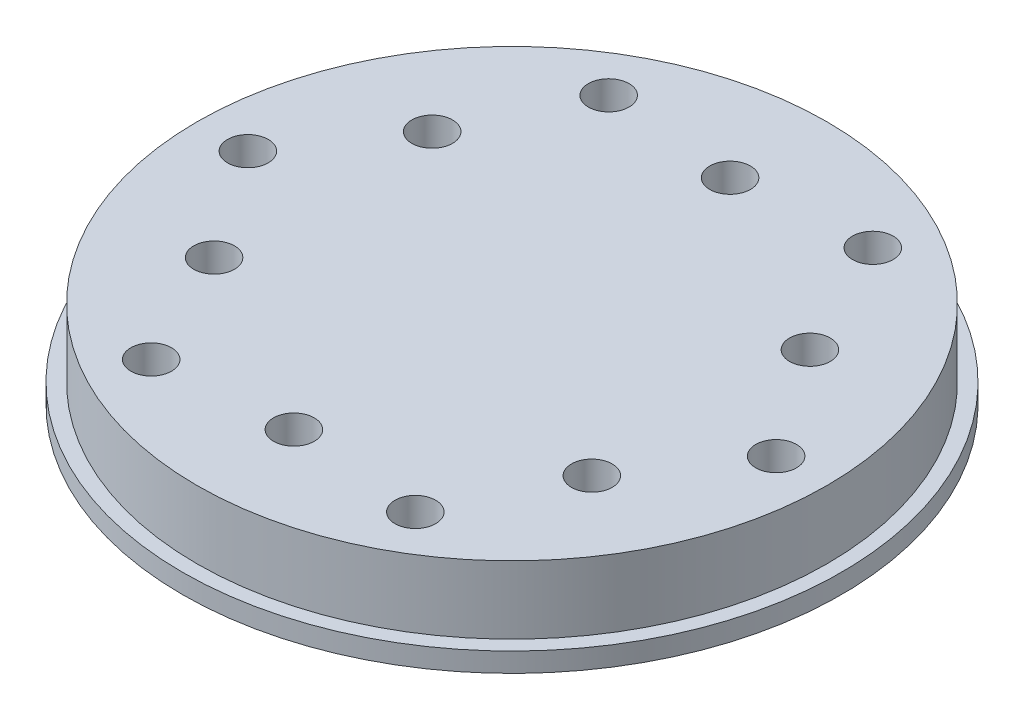
from build123d import *

# Parameters (mm, degrees)
SKETCH2_R             = 32.5
SKETCH2_R_2           = 6.5
SKETCH2_R_3           = 1.5
BOSS_EXTRUDE1_DEPTH   = 10
M5X0_8_TAPPED_HOLE1_D = 4.2
BOSS_EXTRUDE2_START   = -6.5
SKETCH8_R             = 6.5
BOSS_EXTRUDE2_DEPTH   = 6.5
SKETCH9_R             = 32.5
SKETCH9_R_2           = 17.5
CUT_EXTRUDE1_DEPTH    = 1
SKETCH10_W            = 1.5
SKETCH10_H            = 2
M5X0_8_TAPPED_HOLE2_D = 4.2


with BuildPart() as part:
    # Sketch2 → Boss-Extrude1 (new body)
    with BuildSketch(Plane(origin=(0, 0, 0), x_dir=(1, 0, 0), z_dir=(0, 1, 0))):
        with Locations(Location((0, 0, 0), (0, 0, 270))):
            Circle(SKETCH2_R)
        with Locations(Location((0, 0, 0), (0, 0, 270))):
            Circle(SKETCH2_R_2, mode=Mode.SUBTRACT)
        with Locations(Location((27.25, 0, 0), (0, 0, 270))):
            Circle(SKETCH2_R_3, mode=Mode.SUBTRACT)
        with Locations(Location((13.625, -23.599192253, 0), (0, 0, 270))):
            Circle(SKETCH2_R_3, mode=Mode.SUBTRACT)
        with Locations(Location((-13.625, -23.599192253, 0), (0, 0, 270))):
            Circle(SKETCH2_R_3, mode=Mode.SUBTRACT)
        with Locations(Location((-27.25, 0, 0), (0, 0, 270))):
            Circle(SKETCH2_R_3, mode=Mode.SUBTRACT)
        with Locations(Location((-13.625, 23.599192253, 0), (0, 0, 270))):
            Circle(SKETCH2_R_3, mode=Mode.SUBTRACT)
        with Locations(Location((13.625, 23.599192253, 0), (0, 0, 270))):
            Circle(SKETCH2_R_3, mode=Mode.SUBTRACT)
    extrude(amount=BOSS_EXTRUDE1_DEPTH)

    # M5x0.8 Tapped Hole1 (through all)
    with Locations(Plane(origin=(0, 10, 0), x_dir=(1, 0, 0), z_dir=(0, 1, 0))):
        with Locations((-13.625, 23.599192253), (13.625, 23.599192253), (27.25, 0), (13.625, -23.599192253), (-13.625, -23.599192253), (-27.25, 0)):
            Hole(M5X0_8_TAPPED_HOLE1_D / 2)

    # Sketch8 → Boss-Extrude2 (add)
    with BuildSketch(Plane(origin=(0, 10, 0), x_dir=(1, 0, 0), z_dir=(0, 1, 0)).offset(BOSS_EXTRUDE2_START)):
        with Locations(Location((0, 0, 0), (0, 0, 270))):
            Circle(SKETCH8_R)
    extrude(amount=BOSS_EXTRUDE2_DEPTH)

    # Sketch9 → Cut-Extrude1 (cut)
    with BuildSketch(Plane.XZ):
        with Locations(Location((0, 0, 0), (0, 0, 270))):
            Circle(SKETCH9_R)
        with Locations(Location((0, 0, 0), (0, 0, 270))):
            Circle(SKETCH9_R_2, mode=Mode.SUBTRACT)
    extrude(amount=-CUT_EXTRUDE1_DEPTH, mode=Mode.SUBTRACT)

    # Sketch10 → Revolve1 (revolve)
    with BuildSketch(Plane(origin=(0, 0, 0), x_dir=(0, 0, -1), z_dir=(1, 0, 0)), mode=Mode.PRIVATE) as revolve1_sk:
        with Locations((-33.25, 2)):
            Rectangle(SKETCH10_W, SKETCH10_H)
    revolve(revolve1_sk.sketch.rotate(Axis((0, 0, 0), (0, 1, 0)), 180), axis=Axis((0, 0, 0), (0, 1, 0)))

    # M5x0.8 Tapped Hole2 (through all)
    with Locations(Plane(origin=(0, 10, 0), x_dir=(1, 0, 0), z_dir=(0, 1, 0))):
        with Locations((0, 22.5), (19.485571585, 11.25), (19.485571585, -11.25), (0, -22.5), (-19.485571585, -11.25), (-19.485571585, 11.25)):
            Hole(M5X0_8_TAPPED_HOLE2_D / 2)


solid = part.part
